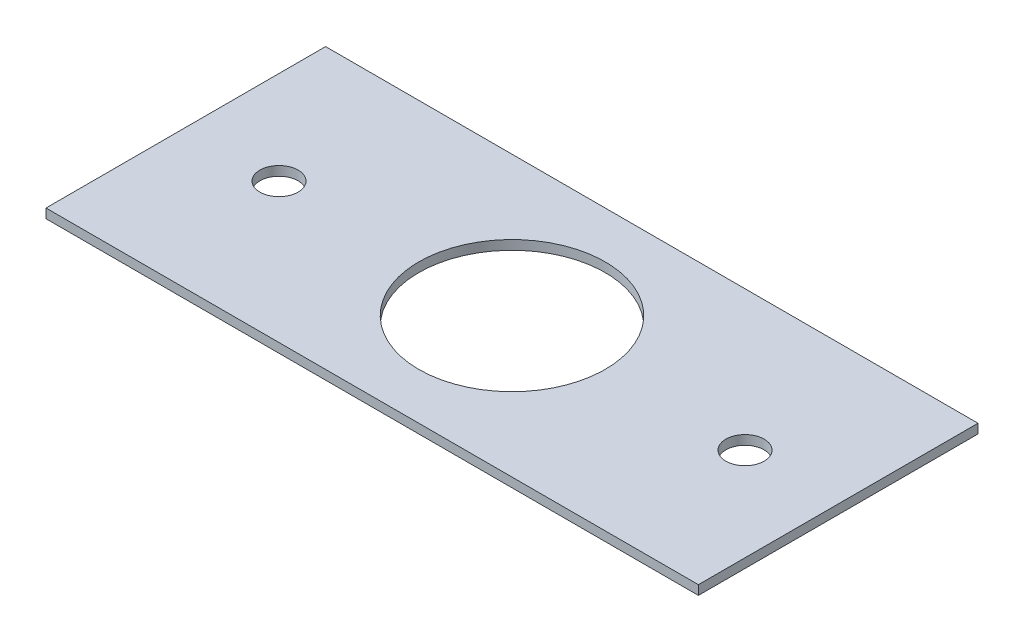
from build123d import *

# Parameters (mm, degrees)
SKETCH1_W           = 70
SKETCH1_H           = 30
SKETCH1_R           = 10
SKETCH1_R_2         = 2.05
BOSS_EXTRUDE1_DEPTH = 1


with BuildPart() as part:
    # Sketch1 → Boss-Extrude1 (new body)
    with BuildSketch(Plane(origin=(0, 0, 0), x_dir=(1, 0, 0), z_dir=(0, 1, 0))):
        Rectangle(SKETCH1_W, SKETCH1_H)
        with Locations(Location((0, 0, 0), (0, 0, 270))):
            Circle(SKETCH1_R, mode=Mode.SUBTRACT)
        with Locations(Location((-25, 0, 0), (0, 0, 270))):
            Circle(SKETCH1_R_2, mode=Mode.SUBTRACT)
        with Locations(Location((25, 0, 0), (0, 0, 270))):
            Circle(SKETCH1_R_2, mode=Mode.SUBTRACT)
    extrude(amount=BOSS_EXTRUDE1_DEPTH)


solid = part.part
